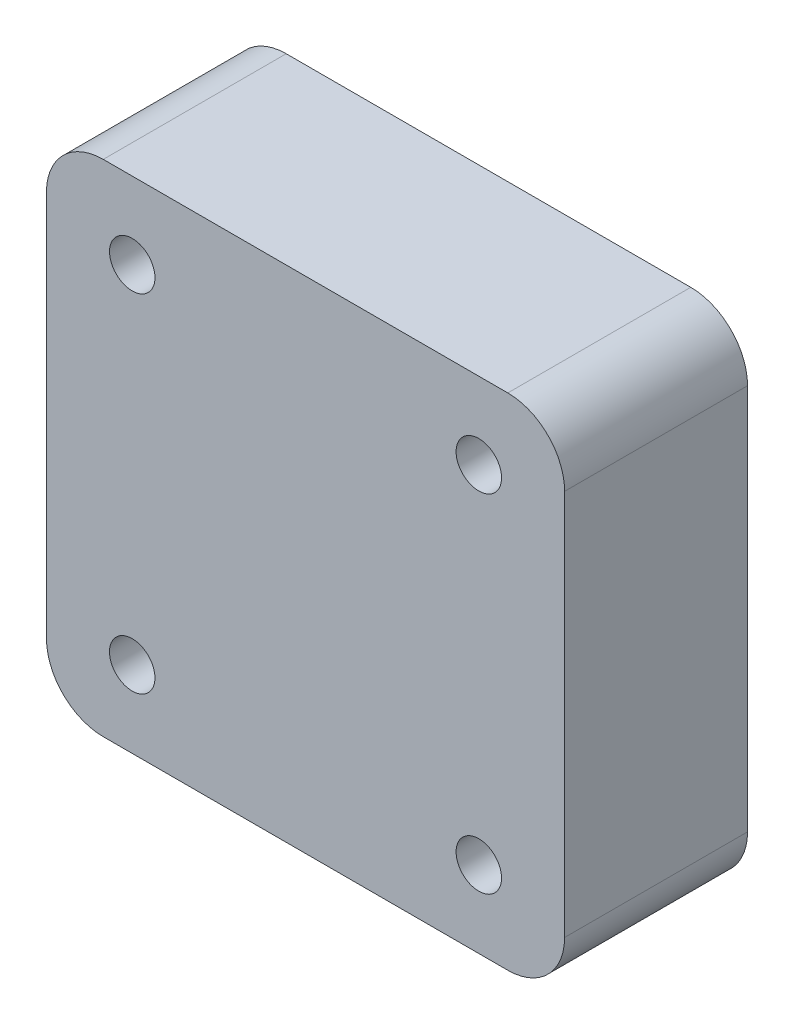
from build123d import *

# Parameters (mm, degrees)
SKETCH3_R           = 2
BOSS_EXTRUDE1_DEPTH = 16.1


with BuildPart() as part:
    # Sketch3 → Boss-Extrude1 (new body)
    with BuildSketch(Plane.XY):
        with BuildLine():
            Line((-17.8, -22), (17.8, -22))
            ThreePointArc((17.8, -22), (21.335533906, -20.535533906), (22.8, -17))
            Line((22.8, -17), (22.8, 17))
            ThreePointArc((22.8, 17), (21.335533906, 20.535533906), (17.8, 22))
            Line((17.8, 22), (-17.8, 22))
            ThreePointArc((-17.8, 22), (-21.335533906, 20.535533906), (-22.8, 17))
            Line((-22.8, 17), (-22.8, -17))
            ThreePointArc((-22.8, -17), (-21.335533906, -20.535533906), (-17.8, -22))
        make_face()
        with Locations((-15.25, 15.25)):
            Circle(SKETCH3_R, mode=Mode.SUBTRACT)
        with Locations(Location((15.25, 15.25, 0), (0, 0, 180))):
            Circle(SKETCH3_R, mode=Mode.SUBTRACT)
        with Locations((15.25, -15.25)):
            Circle(SKETCH3_R, mode=Mode.SUBTRACT)
        with Locations(Location((-15.25, -15.25, 0), (0, 0, 180))):
            Circle(SKETCH3_R, mode=Mode.SUBTRACT)
    extrude(amount=BOSS_EXTRUDE1_DEPTH)


solid = part.part
